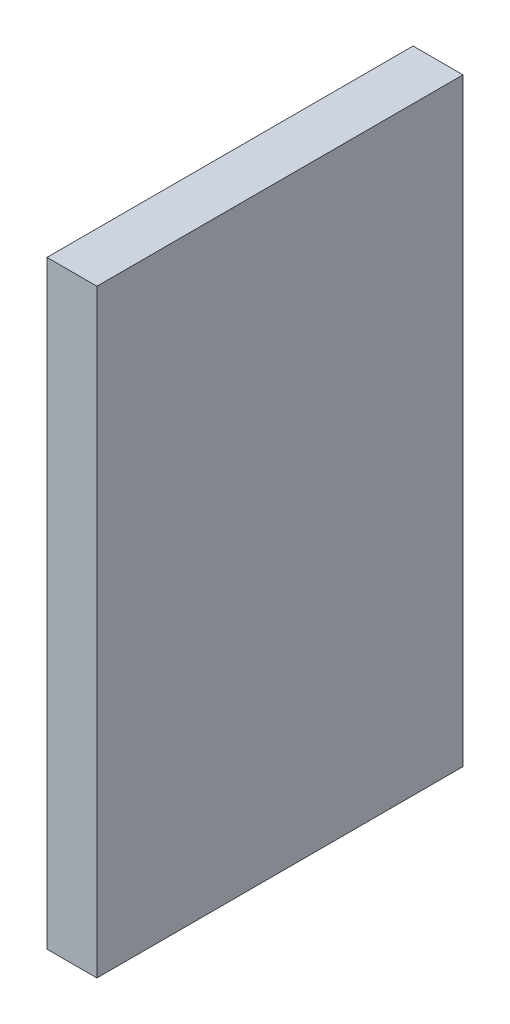
from build123d import *

# Parameters (mm, degrees)
SKETCH1_W           = 75
SKETCH1_H           = 550
BOSS_EXTRUDE1_DEPTH = 900


with BuildPart() as part:
    # Sketch1 → Boss-Extrude1 (new body)
    with BuildSketch(Plane(origin=(0, 0, 0), x_dir=(1, 0, 0), z_dir=(0, 1, 0))):
        with Locations((0, -275)):
            Rectangle(SKETCH1_W, SKETCH1_H)
    extrude(amount=-BOSS_EXTRUDE1_DEPTH)


solid = part.part
